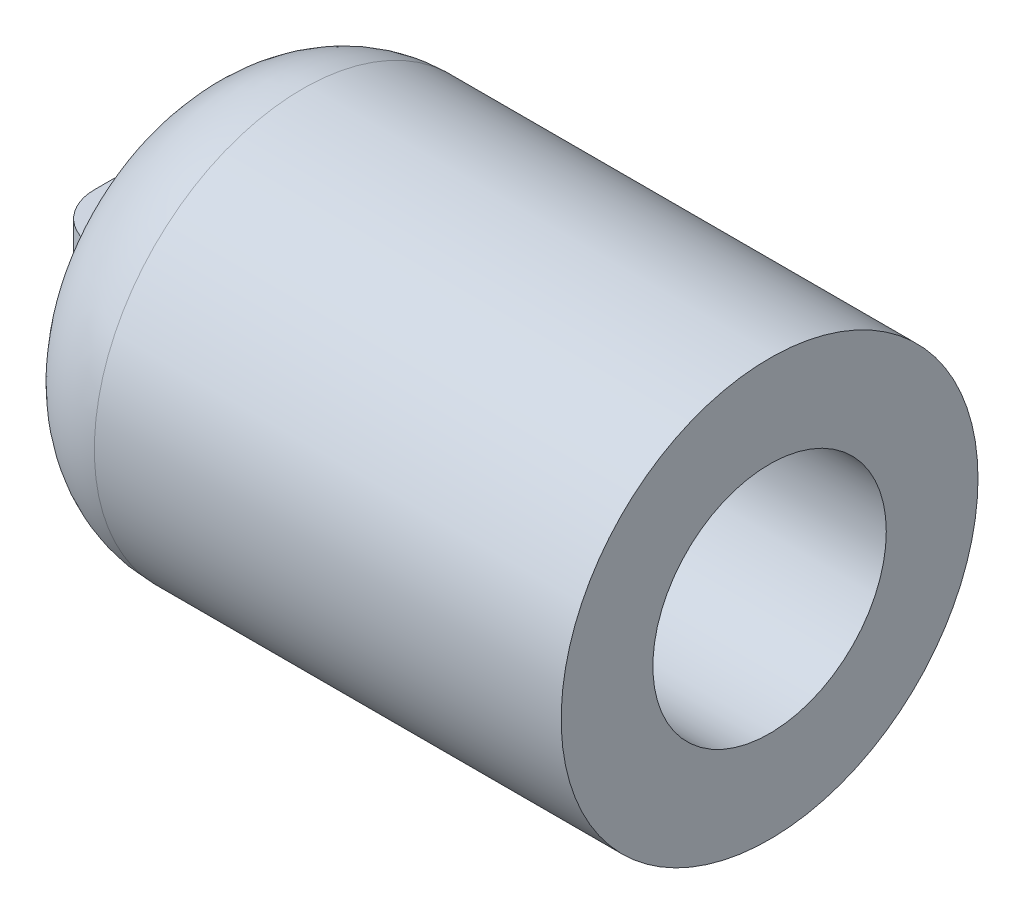
from build123d import *

# Parameters (mm, degrees)
SKETCH_1_R          = 12.5
EXTRUDE_1_DEPTH     = 35
SKETCH_3_W          = 7
SKETCH_3_H          = 3
EXTRUDE_2_DEPTH     = 5
SKETCH_4_R          = 1.5
CUT_EXTRUDE_1_DEPTH = 5
FILLET_1_R          = 3
FILLET_2_R          = 3
FILLET_3_R          = 7
SKETCH_5_R          = 7
CUT_EXTRUDE_2_DEPTH = 30


with BuildPart() as part:
    # 草图1 → 凸台-拉伸1 (new body)
    with BuildSketch(Plane(origin=(0, 0, 0), x_dir=(0, 0, -1), z_dir=(1, 0, 0))):
        Circle(SKETCH_1_R)
    extrude(amount=-EXTRUDE_1_DEPTH)

    # 草图3 → 凸台-拉伸2 (add)
    with BuildSketch(Plane.ZY.offset(35)):
        Rectangle(SKETCH_3_W, SKETCH_3_H)
    extrude(amount=EXTRUDE_2_DEPTH)

    # 草图4 → 切除-拉伸1 (cut)
    with BuildSketch(Plane.XZ.offset(1.5)):
        with Locations(Location((-37.5, 0, 0), (0, 0, 270))):
            Circle(SKETCH_4_R)
    extrude(amount=-CUT_EXTRUDE_1_DEPTH, mode=Mode.SUBTRACT)

    # 圆角1
    fillet_1_edges = [part.edges().sort_by_distance(p)[0] for p in [
        (-40, 0, 3.5),
    ]]
    fillet(fillet_1_edges, radius=FILLET_1_R)

    # 圆角2
    fillet_2_edges = [part.edges().sort_by_distance(p)[0] for p in [
        (-40, 0, -3.5),
    ]]
    fillet(fillet_2_edges, radius=FILLET_2_R)

    # 圆角3
    fillet_3_edges = [part.edges().sort_by_distance(p)[0] for p in [
        (-35, 0, 12.5),
    ]]
    fillet(fillet_3_edges, radius=FILLET_3_R)

    # 草图5 → 切除-拉伸2 (cut)
    with BuildSketch(Plane(origin=(0, 0, 0), x_dir=(0, 0, -1), z_dir=(1, 0, 0))):
        Circle(SKETCH_5_R)
    extrude(amount=-CUT_EXTRUDE_2_DEPTH, mode=Mode.SUBTRACT)


solid = part.part
